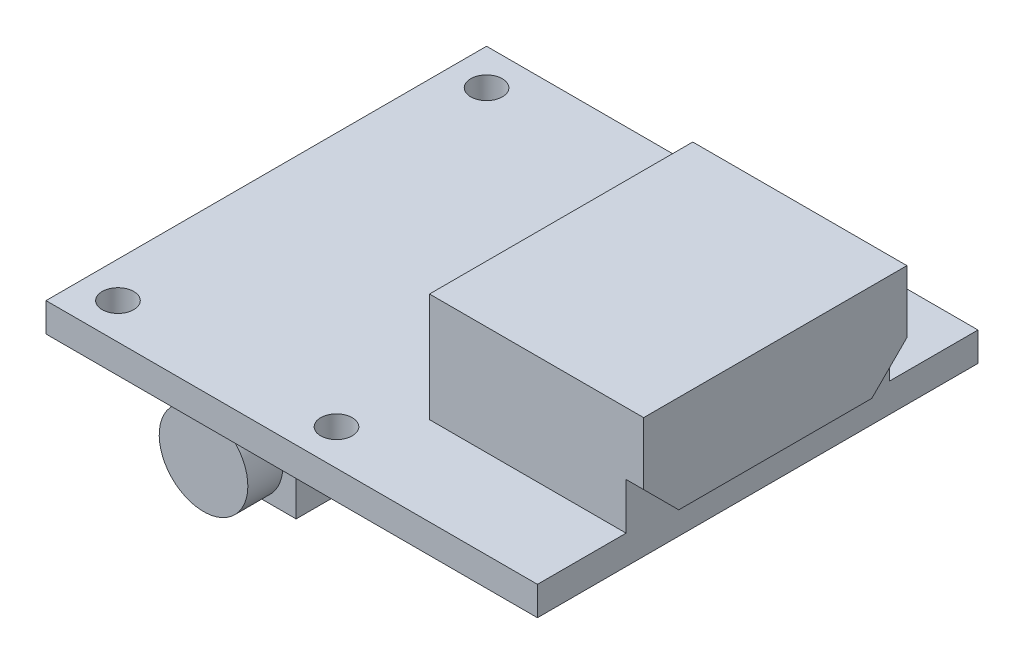
from build123d import *

# Parameters (mm, degrees)
SKETCH1_W           = 28
SKETCH1_H           = 25.1
BOSS_EXTRUDE1_DEPTH = 1.65
SKETCH2_W           = 11.2
SKETCH2_H           = 15
BOSS_EXTRUDE2_DEPTH = 6.2
BOSS_EXTRUDE3_DEPTH = 1
SKETCH4_W           = 6.55
SKETCH4_H           = 11.95
BOSS_EXTRUDE4_DEPTH = 4.5
SKETCH5_R           = 2.525
BOSS_EXTRUDE5_DEPTH = 2
SKETCH6_R           = 0.9
CUT_EXTRUDE1_DEPTH  = 22.074273416


with BuildPart() as part:
    # Sketch1 → Boss-Extrude1 (new body)
    with BuildSketch(Plane(origin=(0, 0, 0), x_dir=(1, 0, 0), z_dir=(0, 1, 0))):
        Rectangle(SKETCH1_W, SKETCH1_H)
    extrude(amount=BOSS_EXTRUDE1_DEPTH)

    # Sketch2 → Boss-Extrude2 (add)
    with BuildSketch(Plane(origin=(0, 1.65, 0), x_dir=(1, 0, 0), z_dir=(0, 1, 0))):
        with Locations((8.4, 0)):
            Rectangle(SKETCH2_W, SKETCH2_H)
    extrude(amount=BOSS_EXTRUDE2_DEPTH)

    # Sketch3 → Boss-Extrude3 (add)
    with BuildSketch(Plane(origin=(14, 0, 0), x_dir=(0, 0, -1), z_dir=(1, 0, 0))):
        Polygon((-7.5, 4.3), (-7.5, 7.85), (7.5, 7.85), (7.5, 4.3), (5.5, 2.3), (-5.5, 2.3), align=None)
    extrude(amount=BOSS_EXTRUDE3_DEPTH)

    # Sketch4 → Boss-Extrude4 (add)
    with BuildSketch(Plane.XZ):
        with Locations((-5.525, 4.075)):
            Rectangle(SKETCH4_W, SKETCH4_H)
    extrude(amount=BOSS_EXTRUDE4_DEPTH)

    # Sketch5 → Boss-Extrude5 (add)
    with BuildSketch(Plane.XY.offset(10.05)):
        with Locations((-5.525, -2.25)):
            Circle(SKETCH5_R)
    extrude(amount=BOSS_EXTRUDE5_DEPTH)

    # Sketch6 → Cut-Extrude1 (cut, through all)
    with BuildSketch(Plane(origin=(0, 0, 0), x_dir=(-1, 0, 0), z_dir=(0, -1, 0))):
        with Locations(Location((11.95, -10.5, 0), (0, 0, 90))):
            Circle(SKETCH6_R)
        with Locations(Location((11.95, 10.5, 0), (0, 0, 90))):
            Circle(SKETCH6_R)
        with Locations(Location((-0.5, 10.5, 0), (0, 0, 90))):
            Circle(SKETCH6_R)
        with Locations(Location((-0.5, -10.5, 0), (0, 0, 90))):
            Circle(SKETCH6_R)
    extrude(amount=-CUT_EXTRUDE1_DEPTH, mode=Mode.SUBTRACT)


solid = part.part
